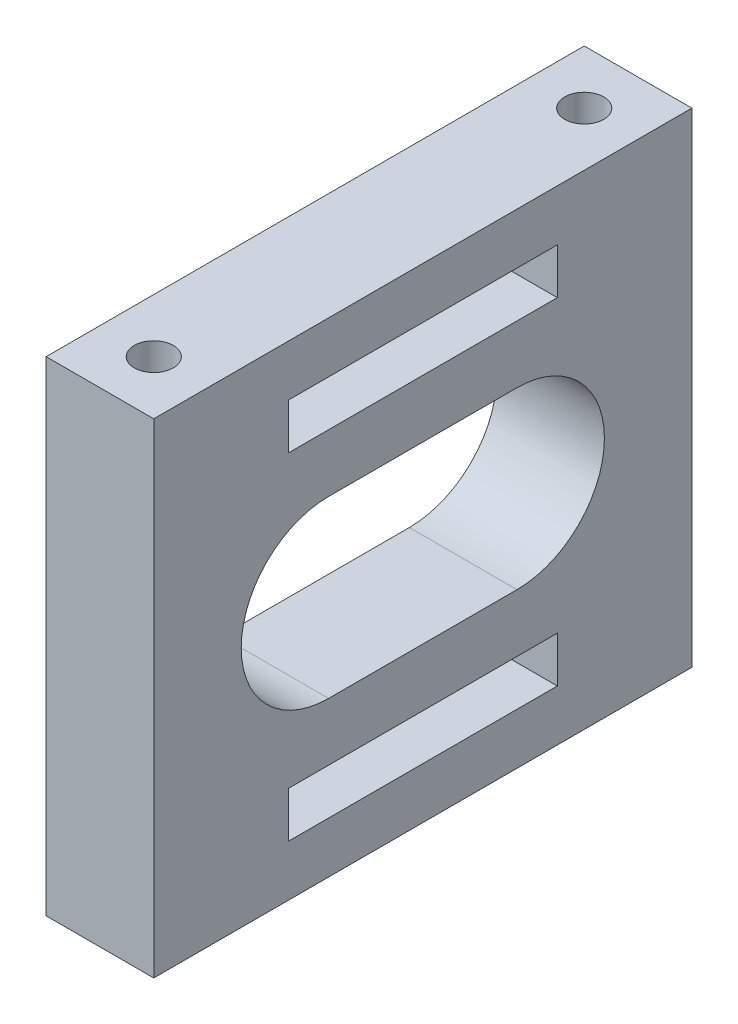
from build123d import *

# Parameters (mm, degrees)
SKETCH1_W           = 40
SKETCH1_H           = 36
BOSS_EXTRUDE1_DEPTH = 8
SKETCH2_R           = 6
CUT_EXTRUDE1_DEPTH  = 55.405882035
SKETCH3_W           = 20
SKETCH3_H           = 3.4
CUT_EXTRUDE2_DEPTH  = 55.405882035
SKETCH6_R           = 1.45
CUT_EXTRUDE3_DEPTH  = 55.405882035
SKETCH7_R           = 6.5
SKETCH7_W           = 14
SKETCH7_H           = 13
CUT_EXTRUDE4_DEPTH  = 55.405882035


with BuildPart() as part:
    # Sketch1 → Boss-Extrude1 (new body)
    with BuildSketch(Plane(origin=(0, 0, 0), x_dir=(0, 0, -1), z_dir=(1, 0, 0))):
        with Locations((20, -18)):
            Rectangle(SKETCH1_W, SKETCH1_H)
    extrude(amount=BOSS_EXTRUDE1_DEPTH)

    # Sketch2 → Cut-Extrude1 (cut, through all)
    with BuildSketch(Plane(origin=(8, 0, 0), x_dir=(0, 0, -1), z_dir=(1, 0, 0))):
        with Locations((20, -18)):
            Circle(SKETCH2_R)
    extrude(amount=-CUT_EXTRUDE1_DEPTH, mode=Mode.SUBTRACT)

    # Sketch3 → Cut-Extrude2 (cut, through all)
    with BuildSketch(Plane(origin=(8, 0, 0), x_dir=(0, 0, -1), z_dir=(1, 0, 0))):
        with Locations((20, -5.5)):
            Rectangle(SKETCH3_W, SKETCH3_H)
        with Locations((20, -30.5)):
            Rectangle(SKETCH3_W, SKETCH3_H)
    extrude(amount=-CUT_EXTRUDE2_DEPTH, mode=Mode.SUBTRACT)

    # Sketch6 → Cut-Extrude3 (cut, through all)
    with BuildSketch(Plane(origin=(0, 0, 0), x_dir=(1, 0, 0), z_dir=(0, 1, 0))):
        with Locations(Location((4, 4, 0), (0, 0, 270))):
            Circle(SKETCH6_R)
        with Locations(Location((4, 36, 0), (0, 0, 270))):
            Circle(SKETCH6_R)
    extrude(amount=-CUT_EXTRUDE3_DEPTH, mode=Mode.SUBTRACT)

    # Sketch7 → Cut-Extrude4 (cut, through all)
    with BuildSketch(Plane(origin=(8, 0, 0), x_dir=(0, 0, -1), z_dir=(1, 0, 0))):
        with Locations((27, -18)):
            Circle(SKETCH7_R)
        with Locations((13, -18)):
            Circle(SKETCH7_R)
        with Locations((20, -18)):
            Rectangle(SKETCH7_W, SKETCH7_H)
    extrude(amount=-CUT_EXTRUDE4_DEPTH, mode=Mode.SUBTRACT)


solid = part.part
